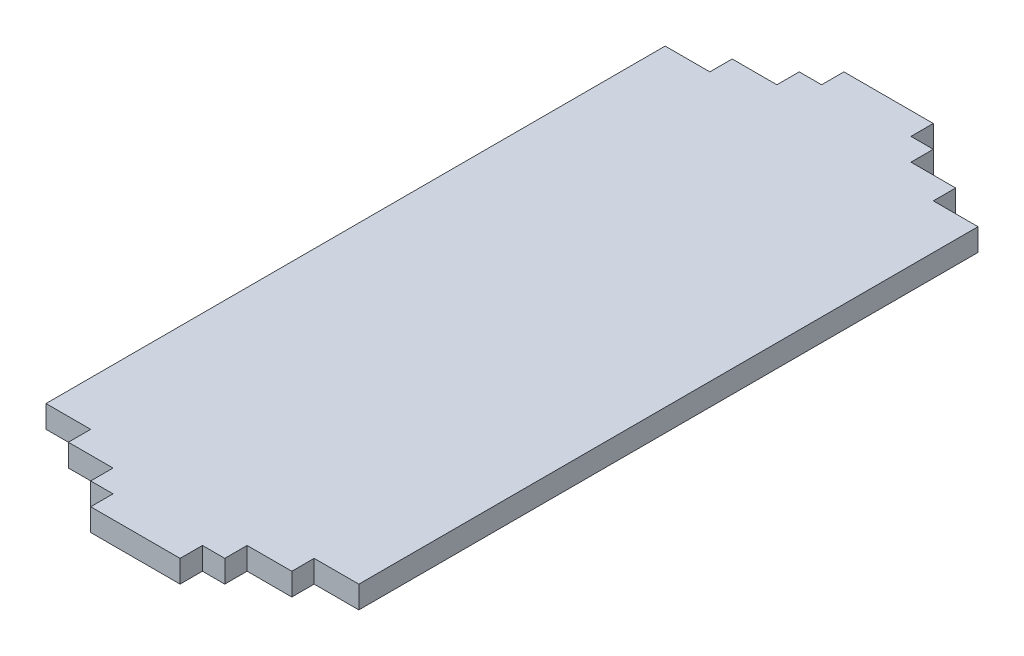
from build123d import *

# Parameters (mm, degrees)
SKETCH1_W           = 44.45
SKETCH1_H           = 3.175
BOSS_EXTRUDE1_DEPTH = 107.022511
CUT_EXTRUDE1_DEPTH  = 253.262317967


with BuildPart() as part:
    # Sketch1 → Boss-Extrude1 (new body)
    with BuildSketch(Plane.XY):
        with Locations((-206.187737343, 34.464226646)):
            Rectangle(SKETCH1_W, SKETCH1_H)
    extrude(amount=-BOSS_EXTRUDE1_DEPTH)

    # Sketch2 → Cut-Extrude1 (cut, through all)
    with BuildSketch(Plane(origin=(0, 36.051726646, 0), x_dir=(1, 0, 0), z_dir=(0, 1, 0))):
        Polygon((-228.412737343, 107.022511379), (-222.062737343, 107.022511379), (-215.712737343, 107.022511379), (-212.537737343, 107.022511379), (-212.537737343, 103.847511379), (-215.712737343, 103.847511379), (-215.712737343, 100.672511379), (-222.062737343, 100.672511379), (-222.062737343, 97.497511379), (-228.412737343, 97.497511379), align=None)
        Polygon((-183.962737343, 107.022511379), (-190.312737343, 107.022511379), (-196.662737343, 107.022511379), (-199.837737343, 107.022511379), (-199.837737343, 103.847511379), (-196.662737343, 103.847511379), (-196.662737343, 100.672511379), (-190.312737343, 100.672511379), (-190.312737343, 97.497511379), (-183.962737343, 97.497511379), align=None)
        Polygon((-228.412737343, 0), (-222.062737343, 0), (-215.712737343, 0), (-212.537737343, 0), (-212.537737343, 3.175), (-215.712737343, 3.175), (-215.712737343, 6.35), (-222.062737343, 6.35), (-222.062737343, 9.525), (-228.412737343, 9.525), align=None)
        Polygon((-183.962737343, 0), (-190.312737343, 0), (-196.662737343, 0), (-199.837737343, 0), (-199.837737343, 3.175), (-196.662737343, 3.175), (-196.662737343, 6.35), (-190.312737343, 6.35), (-190.312737343, 9.525), (-183.962737343, 9.525), align=None)
    extrude(amount=-CUT_EXTRUDE1_DEPTH, mode=Mode.SUBTRACT)


solid = part.part
